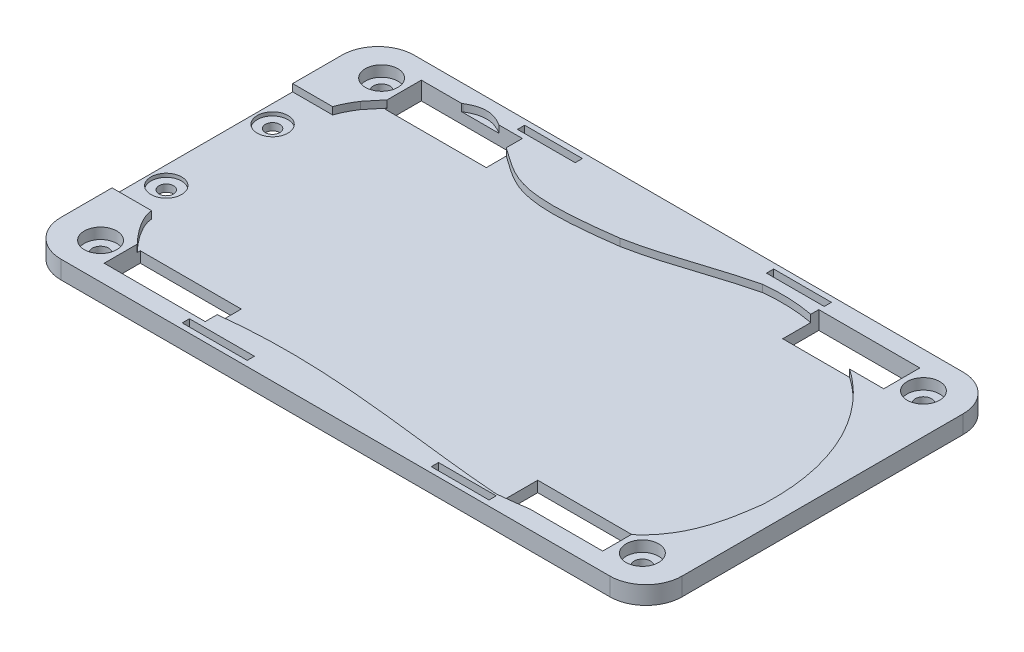
from build123d import *

# Parameters (mm, degrees)
BOSS_EXTRUDE2_DEPTH        = 6.5
CUT_EXTRUDE1_DEPTH         = 2.5
SKETCH7_W                  = 15.126318285
SKETCH7_H                  = 50.045217971
CUT_EXTRUDE2_DEPTH         = 2.5
SKETCH9_R                  = 4.5
CUT_EXTRUDE5_DEPTH         = 3.5
SKETCH10_R                 = 2.25
CUT_EXTRUDE6_DEPTH         = 21
SKETCH8_W                  = 28
SKETCH8_H                  = 10
CUT_EXTRUDE8_DEPTH         = 42
SKETCH8_3_W                = 12
SKETCH8_3_H                = 10
SKETCH8_3_R                = 3.5
CUT_EXTRUDE9_DEPTH         = 1
MIRROR2_COPY_1_SKETCH_R    = 4.5
MIRROR2_COPY_1_DEPTH       = 3.5
MIRROR2_COPY_2_SKETCH_R    = 2.25
MIRROR2_COPY_2_DEPTH       = 21
MIRROR2_COPY_3_SKETCH_W    = 28
MIRROR2_COPY_3_SKETCH_H    = 10
MIRROR2_COPY_3_DEPTH       = 42
MIRROR2_COPY_4_SKETCH_W    = 12
MIRROR2_COPY_4_SKETCH_H    = 10
MIRROR2_COPY_4_SKETCH_R    = 3.5
MIRROR2_COPY_4_DEPTH       = 1
SKETCH13_W                 = 122.138782423
SKETCH13_H                 = 57.881417702
CUT_EXTRUDE10_DEPTH        = 1
SKETCH14_R                 = 2.5
CUT_EXTRUDE11_DEPTH        = 57
SKETCH16_W                 = 16
SKETCH16_H                 = 2
SKETCH16_W_2               = 18
CUT_EXTRUDE12_DEPTH        = 57
SKETCH17_W                 = 198.020150231
SKETCH17_H                 = 122.239022266
CUT_EXTRUDE14_DEPTH        = 48.5
SKETCH23_R                 = 2
CUT_EXTRUDE15_DEPTH        = 48.5
SKETCH23_3_R               = 4.25
SKETCH23_3_R_2             = 2
CUT_EXTRUDE16_DEPTH        = 1
SKETCH24_R                 = 3.25
SKETCH24_R_2               = 2.25
BOSS_EXTRUDE3_DEPTH        = 3
MIRROR5_COPY_1_SKETCH_R    = 4.5
MIRROR5_COPY_1_DEPTH       = 3.5
MIRROR5_COPY_2_SKETCH_R    = 2.25
MIRROR5_COPY_2_DEPTH       = 21
MIRROR5_COPY_3_SKETCH_W    = 28
MIRROR5_COPY_3_SKETCH_H    = 10
MIRROR5_COPY_3_DEPTH       = 42
MIRROR5_COPY_4_SKETCH_W    = 12
MIRROR5_COPY_4_SKETCH_H    = 10
MIRROR5_COPY_4_SKETCH_R    = 3.5
MIRROR5_COPY_4_DEPTH       = 1
MIRROR5_COPY_5_SKETCH_R    = 4.5
MIRROR5_COPY_5_DEPTH       = 3.5
MIRROR5_COPY_6_SKETCH_R    = 2.25
MIRROR5_COPY_6_DEPTH       = 21
MIRROR5_COPY_7_SKETCH_W    = 28
MIRROR5_COPY_7_SKETCH_H    = 10
MIRROR5_COPY_7_DEPTH       = 42
MIRROR5_COPY_8_SKETCH_W    = 12
MIRROR5_COPY_8_SKETCH_H    = 10
MIRROR5_COPY_8_SKETCH_R    = 3.5
MIRROR5_COPY_8_DEPTH       = 1
MIRROR5_COPY_9_SKETCH_R    = 4.5
MIRROR5_COPY_9_DEPTH       = 3.5
MIRROR5_COPY_10_SKETCH_R   = 2.25
MIRROR5_COPY_10_DEPTH      = 21
MIRROR5_COPY_11_SKETCH_W   = 28
MIRROR5_COPY_11_SKETCH_H   = 10
MIRROR5_COPY_11_DEPTH      = 42
MIRROR5_COPY_12_SKETCH_W   = 12
MIRROR5_COPY_12_SKETCH_H   = 10
MIRROR5_COPY_12_SKETCH_R   = 3.5
MIRROR5_COPY_12_DEPTH      = 1
MIRROR5_COPY_13_SKETCH_R   = 2
MIRROR5_COPY_13_DEPTH      = 48.5
MIRROR5_COPY_14_SKETCH_R   = 4.25
MIRROR5_COPY_14_SKETCH_R_2 = 2
MIRROR5_COPY_14_DEPTH      = 1
CUT_EXTRUDE18_START        = -5.5
SKETCH25_W                 = 220.332555495
SKETCH25_H                 = 149.430085415
CUT_EXTRUDE18_DEPTH        = 8.5
SKETCH26_W                 = 210.742237729
SKETCH26_H                 = 121.214001519
CUT_EXTRUDE19_DEPTH        = 0.5
SKETCH27_W                 = 119.619080446
SKETCH27_H                 = 53.164035754
BOSS_EXTRUDE4_DEPTH        = 3


with BuildPart() as part:
    # Sketch6 → Boss-Extrude2 (new body)
    with BuildSketch(Plane(origin=(0, 0, 0), x_dir=(1, 0, 0), z_dir=(0, 1, 0))):
        with BuildLine():
            Line((73.981646775, 59.583909473), (-78.157135648, 59.583909473))
            ThreePointArc((-78.157135648, 59.583909473), (-85.22820346, 56.654977285), (-88.157135648, 49.583909473))
            Line((-88.157135648, 49.583909473), (-88.157135648, -28.297508229))
            ThreePointArc((-88.157135648, -28.297508229), (-85.22820346, -35.368576041), (-78.157135648, -38.297508229))
            Line((-78.157135648, -38.297508229), (73.981646775, -38.297508229))
            ThreePointArc((73.981646775, -38.297508229), (81.052714587, -35.368576041), (83.981646775, -28.297508229))
            Line((83.981646775, -28.297508229), (83.981646775, 49.583909473))
            ThreePointArc((83.981646775, 49.583909473), (81.052714587, 56.654977285), (73.981646775, 59.583909473))
        make_face()
    boss_extrude2 = extrude(amount=BOSS_EXTRUDE2_DEPTH)

    # Sketch1 → Cut-Extrude1 (cut)
    with BuildSketch(Plane(origin=(0, 0, 0), x_dir=(1, 0, 0), z_dir=(0, 1, 0))):
        with BuildLine():
            Line((77.806365081, -0.96565382), (-77.157134057, -0.96565382))
            Line((-77.157134057, -0.96565382), (-77.157133487, -14.112200011))
            add(Edge.make_bspline(
                [(-77.157133487, -14.112200011), (-77.156536942, -14.370123486), (-77.109197781, -14.873209632), (-76.835922488, -15.955912897), (-76.187889009, -17.500769448), (-75.043983016, -19.418277882), (-73.152039277, -22.009216703), (-70.349522729, -25.082160357), (-66.873619377, -28.097169115), (-63.686430755, -30.214139025), (-61.001852204, -31.406236435), (-58.827378352, -31.848010778), (-57.571800044, -31.879365283), (-56.919048161, -31.916770504)],
                knots=[0.000484301, 0.000484301, 0.000484301, 0.000484301, 0.031521334, 0.062558366, 0.124632431, 0.186706496, 0.248780561, 0.37292869, 0.49707682, 0.62122495, 0.745373079, 0.869521209, 0.993669339, 0.993669339, 0.993669339, 0.993669339], degree=3))
            add(Edge.make_bspline(
                [(-56.919048161, -31.916770504), (-56.676855651, -31.887329504), (-56.202107187, -31.827411173), (-55.17909933, -31.687000892), (-53.829380758, -31.487736495), (-52.075898695, -31.218386946), (-49.57440565, -30.835368063), (-46.14645809, -30.337211074), (-41.582465958, -29.781294531), (-36.59758114, -29.326101352), (-29.427370913, -28.913030471), (-19.557102597, -28.846779859), (-6.483877393, -29.587535165), (5.244808229, -30.786505775), (15.023020088, -31.929485511), (22.521025078, -32.809036887), (30.153844065, -33.641998773), (35.340846207, -34.107490241), (37.926285135, -34.298975741)],
                knots=[0.000538145, 0.000538145, 0.000538145, 0.000538145, 0.016151963, 0.031765781, 0.062993416, 0.094221052, 0.125448688, 0.18790396, 0.250359232, 0.312814503, 0.375269775, 0.500180319, 0.625090862, 0.750001406, 0.812456678, 0.874911949, 0.937367221, 0.999822493, 0.999822493, 0.999822493, 0.999822493], degree=3))
            ThreePointArc((37.926285135, -34.298975741), (38.702526051, -34.294429262), (39.475271872, -34.220710033))
            add(Edge.make_bspline(
                [(39.475271872, -34.220710033), (41.007855914, -34.057436076), (44.089984585, -33.714701696), (50.083540013, -32.842915348), (57.096899249, -31.185924421), (64.218389099, -27.883874428), (69.776327895, -23.185685517), (73.049743993, -18.278857828), (74.917700916, -14.026885359), (75.980532113, -10.773207259), (76.750872111, -7.572378035), (77.199527425, -5.064024493), (77.479780782, -3.227934), (77.653952405, -2.012317888), (77.758523252, -1.282417326), (77.806365081, -0.96565382)],
                knots=[-0.000308659, -0.000308659, -0.000308659, -0.000308659, 0.063093373, 0.126495404, 0.253299468, 0.380103532, 0.506907596, 0.633711659, 0.697113691, 0.760515723, 0.823917755, 0.887319787, 0.919020803, 0.950721818, 0.978851886, 0.978851886, 0.978851886, 0.978851886], degree=3))
        make_face()
        with BuildLine():
            Line((-77.157135648, 35.76464303), (-77.157134057, -0.96565382))
            Line((-77.157134057, -0.96565382), (77.806365081, -0.96565382))
            add(Edge.make_bspline(
                [(77.806365081, -0.96565382), (77.812438323, -0.925442533), (77.87221605, -0.53245946), (77.930059012, -0.183407073), (77.984899751, 0.147711222)],
                knots=[0.978851886, 0.978851886, 0.978851886, 0.978851886, 0.982422834, 1.01412385, 1.01412385, 1.01412385, 1.01412385], degree=3))
            add(Edge.make_bspline(
                [(77.984899751, 0.147711222), (78.028632075, 1.263321996), (78.063685274, 3.522430751), (77.942610131, 6.756968322), (77.659550444, 9.90467033), (77.073307047, 13.967118446), (75.962568899, 18.783585703), (73.443316656, 25.935742417), (69.020568834, 33.80984715), (62.049489108, 41.493231365), (53.789484117, 47.344418041), (44.612113932, 51.294661515), (34.903628635, 53.280392725), (28.311253849, 53.235690332), (25.060177828, 52.873239487)],
                knots=[0.000169226, 0.000169226, 0.000169226, 0.000169226, 0.031413574, 0.062657922, 0.09390227, 0.125146618, 0.187635314, 0.25012401, 0.375101401, 0.500078793, 0.625056185, 0.750033577, 0.875010969, 0.999988361, 0.999988361, 0.999988361, 0.999988361], degree=3))
            add(Edge.make_bspline(
                [(25.060177828, 52.873239487), (19.895446944, 51.629390577), (12.322434608, 49.13169364), (2.160698602, 45.971278142), (-3.037110446, 44.691336857), (-5.659268145, 44.190364293)],
                knots=[0.000658959, 0.000658959, 0.000658959, 0.000658959, 0.498067368, 0.746771573, 0.995475778, 0.995475778, 0.995475778, 0.995475778], degree=3))
            add(Edge.make_bspline(
                [(-5.659268145, 44.190364293), (-6.687899132, 44.046149587), (-8.728734339, 43.771857825), (-12.963271971, 43.266800577), (-18.182613839, 42.795189919), (-23.901458121, 42.63215561), (-28.830638135, 42.989857068), (-32.966568973, 43.951399156), (-35.917714049, 45.291439085), (-38.19591431, 46.677930402), (-39.939161114, 47.865789175), (-41.506959745, 48.979842665), (-42.863802202, 49.929184347), (-43.616290768, 50.440510486), (-43.98532936, 50.688555671)],
                knots=[-0.00019559, -0.00019559, -0.00019559, -0.00019559, 0.062587211, 0.125370012, 0.250935613, 0.376501215, 0.502066816, 0.627632417, 0.753198019, 0.81598082, 0.87876362, 0.941546421, 0.972937821, 1.004329222, 1.004329222, 1.004329222, 1.004329222], degree=3))
            add(Edge.make_bspline(
                [(-43.98532936, 50.688555671), (-44.244485854, 50.867312015), (-44.768150418, 51.232519494), (-45.750657054, 51.933111662), (-46.891239492, 52.75905139), (-48.145972585, 53.649626958), (-49.697116091, 54.681113287), (-51.460780236, 55.648746777), (-53.407719169, 56.259273829), (-55.251731489, 56.357375065), (-56.710973324, 56.08081223), (-57.794758617, 55.713765742), (-58.546542767, 55.391458897), (-59.229896481, 55.042763399), (-59.583745645, 54.835934013), (-59.770155285, 54.723823826)],
                knots=[-0.002497219, -0.002497219, -0.002497219, -0.002497219, 0.029065652, 0.060628523, 0.123754265, 0.186880007, 0.250005749, 0.376257234, 0.502508718, 0.628760202, 0.755011687, 0.818137429, 0.881263171, 0.944388913, 1.007514655, 1.007514655, 1.007514655, 1.007514655], degree=3))
            add(Edge.make_bspline(
                [(-59.770155285, 54.723823826), (-60.193626174, 54.476092852), (-61.03864602, 53.961192652), (-62.636768194, 52.907176262), (-65.258656407, 50.976312285), (-68.51709364, 48.049765778), (-71.244275363, 45.065662035), (-73.189921829, 42.724657875), (-74.069794154, 41.617885903), (-74.515784144, 41.052117052)],
                knots=[0.000174078, 0.000174078, 0.000174078, 0.000174078, 0.062881444, 0.12558881, 0.251003541, 0.501833004, 0.752662466, 0.878077198, 1.003491929, 1.003491929, 1.003491929, 1.003491929], degree=3))
            add(Edge.make_bspline(
                [(-74.515784144, 41.052117052), (-75.065753244, 40.22169422), (-76.07645723, 38.477870595), (-76.833603448, 36.687528936), (-77.157135648, 35.76464303)],
                knots=[0.499549048, 0.499549048, 0.499549048, 0.499549048, 0.499765799, 0.49998255, 0.49998255, 0.49998255, 0.49998255], degree=3))
        make_face()
    cut_extrude1 = extrude(amount=CUT_EXTRUDE1_DEPTH, mode=Mode.SUBTRACT)

    # Sketch7 → Cut-Extrude2 (cut)
    with BuildSketch(Plane.XZ):
        with Locations((-83.782077592, -10.91040897)):
            Rectangle(SKETCH7_W, SKETCH7_H)
    cut_extrude2 = extrude(amount=-CUT_EXTRUDE2_DEPTH, mode=Mode.SUBTRACT)

    # Sketch9 → Cut-Extrude5 (cut)
    with BuildSketch(Plane.XZ):
        with Locations(Location((72.981646775, -49.583909473, 0), (0, 0, 270))):
            Circle(SKETCH9_R)
    cut_extrude5 = extrude(amount=-CUT_EXTRUDE5_DEPTH, mode=Mode.SUBTRACT)

    # Sketch10 → Cut-Extrude6 (cut)
    with BuildSketch(Plane.XZ.offset(-3.5)):
        with Locations(Location((72.981646775, -49.583909473, 0), (0, 0, 270))):
            Circle(SKETCH10_R)
    cut_extrude6 = extrude(amount=-CUT_EXTRUDE6_DEPTH, mode=Mode.SUBTRACT)

    # Sketch8 → Cut-Extrude8 (cut)
    with BuildSketch(Plane(origin=(0, 6.5, 0), x_dir=(1, 0, 0), z_dir=(0, 1, 0))):
        with Locations((52.981646775, 49.583909473)):
            Rectangle(SKETCH8_W, SKETCH8_H)
    cut_extrude8 = extrude(amount=-CUT_EXTRUDE8_DEPTH, mode=Mode.SUBTRACT)

    # Sketch8<3> → Cut-Extrude9 (cut)
    with BuildSketch(Plane(origin=(0, 6.5, 0), x_dir=(1, 0, 0), z_dir=(0, 1, 0))):
        with Locations((72.981646775, 49.583909473)):
            Rectangle(SKETCH8_3_W, SKETCH8_3_H)
        with Locations(Location((72.981646775, 49.583909473, 0), (0, 0, 270))):
            Circle(SKETCH8_3_R, mode=Mode.SUBTRACT)
    cut_extrude9 = extrude(amount=-CUT_EXTRUDE9_DEPTH, mode=Mode.SUBTRACT)

    # Mirror1: Cut-Extrude5, Cut-Extrude6, Cut-Extrude8, Cut-Extrude9 across plane
    add(cut_extrude5.mirror(Plane.XY.offset(-10.643200622)), mode=Mode.SUBTRACT)
    add(cut_extrude6.mirror(Plane.XY.offset(-10.643200622)), mode=Mode.SUBTRACT)
    add(cut_extrude8.mirror(Plane.XY.offset(-10.643200622)), mode=Mode.SUBTRACT)
    add(cut_extrude9.mirror(Plane.XY.offset(-10.643200622)), mode=Mode.SUBTRACT)

    # Mirror2: Cut-Extrude5, Cut-Extrude6, Cut-Extrude8, Cut-Extrude9 across plane
    add(cut_extrude5.mirror(Plane.ZY.offset(2.087744437)), mode=Mode.SUBTRACT)
    add(cut_extrude6.mirror(Plane.ZY.offset(2.087744437)), mode=Mode.SUBTRACT)
    add(cut_extrude8.mirror(Plane.ZY.offset(2.087744437)), mode=Mode.SUBTRACT)
    add(cut_extrude9.mirror(Plane.ZY.offset(2.087744437)), mode=Mode.SUBTRACT)

    # Mirror2 copy 1 sketch → Mirror2 copy 1 (cut)
    with BuildSketch(Plane(origin=(-4.175488873, 0, -21.286401244), x_dir=(-1, 0, 0), z_dir=(0, -1, 0))):
        with Locations(Location((72.981646775, -49.583909473, 0), (0, 0, 270))):
            Circle(MIRROR2_COPY_1_SKETCH_R)
    extrude(amount=-MIRROR2_COPY_1_DEPTH, mode=Mode.SUBTRACT)

    # Mirror2 copy 2 sketch → Mirror2 copy 2 (cut)
    with BuildSketch(Plane(origin=(-4.175488873, 3.5, -21.286401244), x_dir=(-1, 0, 0), z_dir=(0, -1, 0))):
        with Locations(Location((72.981646775, -49.583909473, 0), (0, 0, 270))):
            Circle(MIRROR2_COPY_2_SKETCH_R)
    extrude(amount=-MIRROR2_COPY_2_DEPTH, mode=Mode.SUBTRACT)

    # Mirror2 copy 3 sketch → Mirror2 copy 3 (cut)
    with BuildSketch(Plane(origin=(-4.175488873, 6.5, -21.286401244), x_dir=(-1, 0, 0), z_dir=(0, 1, 0))):
        with Locations((52.981646775, 49.583909473)):
            Rectangle(MIRROR2_COPY_3_SKETCH_W, MIRROR2_COPY_3_SKETCH_H)
    extrude(amount=-MIRROR2_COPY_3_DEPTH, mode=Mode.SUBTRACT)

    # Mirror2 copy 4 sketch → Mirror2 copy 4 (cut)
    with BuildSketch(Plane(origin=(-4.175488873, 6.5, -21.286401244), x_dir=(-1, 0, 0), z_dir=(0, 1, 0))):
        with Locations((72.981646775, 49.583909473)):
            Rectangle(MIRROR2_COPY_4_SKETCH_W, MIRROR2_COPY_4_SKETCH_H)
        with Locations(Location((72.981646775, 49.583909473, 0), (0, 0, 270))):
            Circle(MIRROR2_COPY_4_SKETCH_R, mode=Mode.SUBTRACT)
    extrude(amount=-MIRROR2_COPY_4_DEPTH, mode=Mode.SUBTRACT)

    # Sketch13 → Cut-Extrude10 (cut)
    with BuildSketch(Plane(origin=(0, 6.5, 0), x_dir=(1, 0, 0), z_dir=(0, 1, 0))):
        with Locations((-2.087744436, 10.643200622)):
            Rectangle(SKETCH13_W, SKETCH13_H)
    cut_extrude10 = extrude(amount=-CUT_EXTRUDE10_DEPTH, mode=Mode.SUBTRACT)

    # Sketch14 → Cut-Extrude11 (cut)
    with BuildSketch(Plane(origin=(0, 5.5, 0), x_dir=(1, 0, 0), z_dir=(0, 1, 0))):
        with Locations(Location((-52.087744437, 30.643200622, 0), (0, 0, 270))):
            Circle(SKETCH14_R)
        with Locations(Location((7.912255563, 30.643200622, 0), (0, 0, 270))):
            Circle(SKETCH14_R)
        with Locations(Location((27.912255563, 30.643200622, 0), (0, 0, 270))):
            Circle(SKETCH14_R)
        with Locations(Location((47.912255563, 30.643200622, 0), (0, 0, 270))):
            Circle(SKETCH14_R)
        with Locations(Location((47.912255563, 10.643200622, 0), (0, 0, 270))):
            Circle(SKETCH14_R)
        with Locations(Location((7.912255563, 10.643200622, 0), (0, 0, 270))):
            Circle(SKETCH14_R)
        with Locations(Location((-12.087744437, 10.643200622, 0), (0, 0, 270))):
            Circle(SKETCH14_R)
        with Locations(Location((-32.087744437, 10.643200622, 0), (0, 0, 270))):
            Circle(SKETCH14_R)
        with Locations(Location((-52.087744437, 10.643200622, 0), (0, 0, 270))):
            Circle(SKETCH14_R)
        with Locations(Location((47.912255563, -9.356799378, 0), (0, 0, 270))):
            Circle(SKETCH14_R)
        with Locations(Location((27.912255563, -9.356799378, 0), (0, 0, 270))):
            Circle(SKETCH14_R)
        with Locations(Location((7.912255563, -9.356799378, 0), (0, 0, 270))):
            Circle(SKETCH14_R)
        with Locations(Location((-12.087744437, -9.356799378, 0), (0, 0, 270))):
            Circle(SKETCH14_R)
        with Locations(Location((-32.087744437, -9.356799378, 0), (0, 0, 270))):
            Circle(SKETCH14_R)
        with Locations(Location((-52.087744437, -9.356799378, 0), (0, 0, 270))):
            Circle(SKETCH14_R)
        with Locations(Location((-32.087744437, 30.643200622, 0), (0, 0, 270))):
            Circle(SKETCH14_R)
        with Locations(Location((-12.087744437, 30.643200622, 0), (0, 0, 270))):
            Circle(SKETCH14_R)
        with Locations(Location((27.912255563, 10.643200622, 0), (0, 0, 270))):
            Circle(SKETCH14_R)
    cut_extrude11 = extrude(amount=-CUT_EXTRUDE11_DEPTH, mode=Mode.SUBTRACT)

    # Sketch16 → Cut-Extrude12 (cut)
    with BuildSketch(Plane.XZ):
        with Locations((30.981646775, -57.083909473)):
            Rectangle(SKETCH16_W, SKETCH16_H)
        with Locations((30.981646775, 35.797508229)):
            Rectangle(SKETCH16_W, SKETCH16_H)
        with Locations((-38.018353225, -57.083909473)):
            Rectangle(SKETCH16_W, SKETCH16_H)
        with Locations((-37.018353225, 35.797508229)):
            Rectangle(SKETCH16_W_2, SKETCH16_H)
    cut_extrude12 = extrude(amount=-CUT_EXTRUDE12_DEPTH, mode=Mode.SUBTRACT)

    # Sketch17 → Cut-Extrude14 (cut)
    with BuildSketch(Plane(origin=(0, 5.5, 0), x_dir=(1, 0, 0), z_dir=(0, 1, 0))):
        with Locations((-0.586253557, 7.90518784)):
            Rectangle(SKETCH17_W, SKETCH17_H)
    cut_extrude14 = extrude(amount=CUT_EXTRUDE14_DEPTH, mode=Mode.SUBTRACT)

    # Sketch23 → Cut-Extrude15 (cut)
    with BuildSketch(Plane.XZ.offset(-2.5)):
        with Locations(Location((-83.157135648, 4.08959103, 0), (0, 0, 270))):
            Circle(SKETCH23_R)
    cut_extrude15 = extrude(amount=-CUT_EXTRUDE15_DEPTH, mode=Mode.SUBTRACT)

    # Sketch23<3> → Cut-Extrude16 (cut)
    with BuildSketch(Plane.XZ.offset(-2.5)):
        with Locations(Location((-83.157135648, 4.08959103, 0), (0, 0, 270))):
            Circle(SKETCH23_3_R)
        with Locations(Location((-83.157135648, 4.08959103, 0), (0, 0, 270))):
            Circle(SKETCH23_3_R_2, mode=Mode.SUBTRACT)
    cut_extrude16 = extrude(amount=-CUT_EXTRUDE16_DEPTH, mode=Mode.SUBTRACT)

    # Mirror4: Cut-Extrude15, Cut-Extrude16 across plane
    add(cut_extrude15.mirror(Plane.XY.offset(-10.643200622)), mode=Mode.SUBTRACT)
    add(cut_extrude16.mirror(Plane.XY.offset(-10.643200622)), mode=Mode.SUBTRACT)

    # Sketch24 → Boss-Extrude3 (add)
    # profile 1 of 4: a face of its own
    with BuildSketch(Plane(origin=(0, 5.5, 0), x_dir=(1, 0, 0), z_dir=(0, 1, 0))):
        with Locations(Location((-77.157135648, 49.583909473, 0), (0, 0, 270))):
            Circle(SKETCH24_R)
        with Locations(Location((-77.157135648, 49.583909473, 0), (0, 0, 90))):
            Circle(SKETCH24_R_2, mode=Mode.SUBTRACT)
    # profile 2 of 4: a face of its own
    with BuildSketch(Plane(origin=(0, 5.5, 0), x_dir=(1, 0, 0), z_dir=(0, 1, 0))):
        with Locations(Location((72.981646775, 49.583909473, 0), (0, 0, 270))):
            Circle(SKETCH24_R)
        with Locations(Location((72.981646775, 49.583909473, 0), (0, 0, 90))):
            Circle(SKETCH24_R_2, mode=Mode.SUBTRACT)
    # profile 3 of 4: a face of its own
    with BuildSketch(Plane(origin=(0, 5.5, 0), x_dir=(1, 0, 0), z_dir=(0, 1, 0))):
        with Locations(Location((-77.157135648, -28.297508229, 0), (0, 0, 270))):
            Circle(SKETCH24_R)
        with Locations(Location((-77.157135648, -28.297508229, 0), (0, 0, 270))):
            Circle(SKETCH24_R_2, mode=Mode.SUBTRACT)
    # profile 4 of 4: a face of its own
    with BuildSketch(Plane(origin=(0, 5.5, 0), x_dir=(1, 0, 0), z_dir=(0, 1, 0))):
        with Locations(Location((72.981646775, -28.297508229, 0), (0, 0, 270))):
            Circle(SKETCH24_R)
        with Locations(Location((72.981646775, -28.297508229, 0), (0, 0, 270))):
            Circle(SKETCH24_R_2, mode=Mode.SUBTRACT)
    boss_extrude3 = extrude(amount=BOSS_EXTRUDE3_DEPTH)

    # Mirror5: Boss-Extrude2, Cut-Extrude1, Cut-Extrude2, Cut-Extrude5, Cut-Extrude6, Cut-Extrude8, Cut-Extrude9, Cut-Extrude10, Cut-Extrude11, Cut-Extrude12, Cut-Extrude14, Cut-Extrude15, Cut-Extrude16, Boss-Extrude3 across plane
    add(boss_extrude2.mirror(Plane(origin=(0, 0, 0), x_dir=(0, 0, 1), z_dir=(0, -1, 0))))
    add(cut_extrude1.mirror(Plane(origin=(0, 0, 0), x_dir=(0, 0, 1), z_dir=(0, -1, 0))), mode=Mode.SUBTRACT)
    add(cut_extrude2.mirror(Plane(origin=(0, 0, 0), x_dir=(0, 0, 1), z_dir=(0, -1, 0))), mode=Mode.SUBTRACT)
    add(cut_extrude5.mirror(Plane(origin=(0, 0, 0), x_dir=(0, 0, 1), z_dir=(0, -1, 0))), mode=Mode.SUBTRACT)
    add(cut_extrude6.mirror(Plane(origin=(0, 0, 0), x_dir=(0, 0, 1), z_dir=(0, -1, 0))), mode=Mode.SUBTRACT)
    add(cut_extrude8.mirror(Plane(origin=(0, 0, 0), x_dir=(0, 0, 1), z_dir=(0, -1, 0))), mode=Mode.SUBTRACT)
    add(cut_extrude9.mirror(Plane(origin=(0, 0, 0), x_dir=(0, 0, 1), z_dir=(0, -1, 0))), mode=Mode.SUBTRACT)
    add(cut_extrude10.mirror(Plane(origin=(0, 0, 0), x_dir=(0, 0, 1), z_dir=(0, -1, 0))), mode=Mode.SUBTRACT)
    add(cut_extrude11.mirror(Plane(origin=(0, 0, 0), x_dir=(0, 0, 1), z_dir=(0, -1, 0))), mode=Mode.SUBTRACT)
    add(cut_extrude12.mirror(Plane(origin=(0, 0, 0), x_dir=(0, 0, 1), z_dir=(0, -1, 0))), mode=Mode.SUBTRACT)
    add(cut_extrude14.mirror(Plane(origin=(0, 0, 0), x_dir=(0, 0, 1), z_dir=(0, -1, 0))), mode=Mode.SUBTRACT)
    add(cut_extrude15.mirror(Plane(origin=(0, 0, 0), x_dir=(0, 0, 1), z_dir=(0, -1, 0))), mode=Mode.SUBTRACT)
    add(cut_extrude16.mirror(Plane(origin=(0, 0, 0), x_dir=(0, 0, 1), z_dir=(0, -1, 0))), mode=Mode.SUBTRACT)
    add(boss_extrude3.mirror(Plane(origin=(0, 0, 0), x_dir=(0, 0, 1), z_dir=(0, -1, 0))))

    # Mirror5 copy 1 sketch → Mirror5 copy 1 (cut)
    with BuildSketch(Plane(origin=(0, 0, -21.286401244), x_dir=(1, 0, 0), z_dir=(0, 1, 0))):
        with Locations(Location((72.981646775, -49.583909473, 0), (0, 0, 270))):
            Circle(MIRROR5_COPY_1_SKETCH_R)
    extrude(amount=-MIRROR5_COPY_1_DEPTH, mode=Mode.SUBTRACT)

    # Mirror5 copy 2 sketch → Mirror5 copy 2 (cut)
    with BuildSketch(Plane(origin=(0, -3.5, -21.286401244), x_dir=(1, 0, 0), z_dir=(0, 1, 0))):
        with Locations(Location((72.981646775, -49.583909473, 0), (0, 0, 270))):
            Circle(MIRROR5_COPY_2_SKETCH_R)
    extrude(amount=-MIRROR5_COPY_2_DEPTH, mode=Mode.SUBTRACT)

    # Mirror5 copy 3 sketch → Mirror5 copy 3 (cut)
    with BuildSketch(Plane(origin=(0, -6.5, -21.286401244), x_dir=(1, 0, 0), z_dir=(0, -1, 0))):
        with Locations((52.981646775, 49.583909473)):
            Rectangle(MIRROR5_COPY_3_SKETCH_W, MIRROR5_COPY_3_SKETCH_H)
    extrude(amount=-MIRROR5_COPY_3_DEPTH, mode=Mode.SUBTRACT)

    # Mirror5 copy 4 sketch → Mirror5 copy 4 (cut)
    with BuildSketch(Plane(origin=(0, -6.5, -21.286401244), x_dir=(1, 0, 0), z_dir=(0, -1, 0))):
        with Locations((72.981646775, 49.583909473)):
            Rectangle(MIRROR5_COPY_4_SKETCH_W, MIRROR5_COPY_4_SKETCH_H)
        with Locations(Location((72.981646775, 49.583909473, 0), (0, 0, 270))):
            Circle(MIRROR5_COPY_4_SKETCH_R, mode=Mode.SUBTRACT)
    extrude(amount=-MIRROR5_COPY_4_DEPTH, mode=Mode.SUBTRACT)

    # Mirror5 copy 5 sketch → Mirror5 copy 5 (cut)
    with BuildSketch(Plane(origin=(-4.175488873, 0, 0), x_dir=(-1, 0, 0), z_dir=(0, 1, 0))):
        with Locations(Location((72.981646775, -49.583909473, 0), (0, 0, 270))):
            Circle(MIRROR5_COPY_5_SKETCH_R)
    extrude(amount=-MIRROR5_COPY_5_DEPTH, mode=Mode.SUBTRACT)

    # Mirror5 copy 6 sketch → Mirror5 copy 6 (cut)
    with BuildSketch(Plane(origin=(-4.175488873, -3.5, 0), x_dir=(-1, 0, 0), z_dir=(0, 1, 0))):
        with Locations(Location((72.981646775, -49.583909473, 0), (0, 0, 270))):
            Circle(MIRROR5_COPY_6_SKETCH_R)
    extrude(amount=-MIRROR5_COPY_6_DEPTH, mode=Mode.SUBTRACT)

    # Mirror5 copy 7 sketch → Mirror5 copy 7 (cut)
    with BuildSketch(Plane(origin=(-4.175488873, -6.5, 0), x_dir=(-1, 0, 0), z_dir=(0, -1, 0))):
        with Locations((52.981646775, 49.583909473)):
            Rectangle(MIRROR5_COPY_7_SKETCH_W, MIRROR5_COPY_7_SKETCH_H)
    extrude(amount=-MIRROR5_COPY_7_DEPTH, mode=Mode.SUBTRACT)

    # Mirror5 copy 8 sketch → Mirror5 copy 8 (cut)
    with BuildSketch(Plane(origin=(-4.175488873, -6.5, 0), x_dir=(-1, 0, 0), z_dir=(0, -1, 0))):
        with Locations((72.981646775, 49.583909473)):
            Rectangle(MIRROR5_COPY_8_SKETCH_W, MIRROR5_COPY_8_SKETCH_H)
        with Locations(Location((72.981646775, 49.583909473, 0), (0, 0, 270))):
            Circle(MIRROR5_COPY_8_SKETCH_R, mode=Mode.SUBTRACT)
    extrude(amount=-MIRROR5_COPY_8_DEPTH, mode=Mode.SUBTRACT)

    # Mirror5 copy 9 sketch → Mirror5 copy 9 (cut)
    with BuildSketch(Plane(origin=(-4.175488873, 0, -21.286401244), x_dir=(-1, 0, 0), z_dir=(0, 1, 0))):
        with Locations((72.981646775, 49.583909473)):
            Circle(MIRROR5_COPY_9_SKETCH_R)
    extrude(amount=-MIRROR5_COPY_9_DEPTH, mode=Mode.SUBTRACT)

    # Mirror5 copy 10 sketch → Mirror5 copy 10 (cut)
    with BuildSketch(Plane(origin=(-4.175488873, -3.5, -21.286401244), x_dir=(-1, 0, 0), z_dir=(0, 1, 0))):
        with Locations((72.981646775, 49.583909473)):
            Circle(MIRROR5_COPY_10_SKETCH_R)
    extrude(amount=-MIRROR5_COPY_10_DEPTH, mode=Mode.SUBTRACT)

    # Mirror5 copy 11 sketch → Mirror5 copy 11 (cut)
    with BuildSketch(Plane(origin=(-4.175488873, -6.5, -21.286401244), x_dir=(-1, 0, 0), z_dir=(0, -1, 0))):
        with Locations((52.981646775, -49.583909473)):
            Rectangle(MIRROR5_COPY_11_SKETCH_W, MIRROR5_COPY_11_SKETCH_H)
    extrude(amount=-MIRROR5_COPY_11_DEPTH, mode=Mode.SUBTRACT)

    # Mirror5 copy 12 sketch → Mirror5 copy 12 (cut)
    with BuildSketch(Plane(origin=(-4.175488873, -6.5, -21.286401244), x_dir=(-1, 0, 0), z_dir=(0, -1, 0))):
        with Locations((72.981646775, -49.583909473)):
            Rectangle(MIRROR5_COPY_12_SKETCH_W, MIRROR5_COPY_12_SKETCH_H)
        with Locations((72.981646775, -49.583909473)):
            Circle(MIRROR5_COPY_12_SKETCH_R, mode=Mode.SUBTRACT)
    extrude(amount=-MIRROR5_COPY_12_DEPTH, mode=Mode.SUBTRACT)

    # Mirror5 copy 13 sketch → Mirror5 copy 13 (cut)
    with BuildSketch(Plane(origin=(0, -2.5, -21.286401244), x_dir=(1, 0, 0), z_dir=(0, 1, 0))):
        with Locations(Location((-83.157135648, 4.08959103, 0), (0, 0, 270))):
            Circle(MIRROR5_COPY_13_SKETCH_R)
    extrude(amount=-MIRROR5_COPY_13_DEPTH, mode=Mode.SUBTRACT)

    # Mirror5 copy 14 sketch → Mirror5 copy 14 (cut)
    with BuildSketch(Plane(origin=(0, -2.5, -21.286401244), x_dir=(1, 0, 0), z_dir=(0, 1, 0))):
        with Locations(Location((-83.157135648, 4.08959103, 0), (0, 0, 270))):
            Circle(MIRROR5_COPY_14_SKETCH_R)
        with Locations(Location((-83.157135648, 4.08959103, 0), (0, 0, 270))):
            Circle(MIRROR5_COPY_14_SKETCH_R_2, mode=Mode.SUBTRACT)
    extrude(amount=-MIRROR5_COPY_14_DEPTH, mode=Mode.SUBTRACT)

    # Sketch25 → Cut-Extrude18 (cut)
    with BuildSketch(Plane(origin=(0, 5.5, 0), x_dir=(1, 0, 0), z_dir=(0, 1, 0)).offset(CUT_EXTRUDE18_START)):
        with Locations((0.879197772, -1.00848127)):
            Rectangle(SKETCH25_W, SKETCH25_H)
    extrude(amount=CUT_EXTRUDE18_DEPTH, mode=Mode.SUBTRACT)

    # Sketch26 → Cut-Extrude19 (cut)
    with BuildSketch(Plane(origin=(0, 0, 0), x_dir=(1, 0, 0), z_dir=(0, 1, 0))):
        with Locations((0.719275932, 8.451886002)):
            Rectangle(SKETCH26_W, SKETCH26_H)
    extrude(amount=-CUT_EXTRUDE19_DEPTH, mode=Mode.SUBTRACT)

    # Sketch27 → Boss-Extrude4 (add)
    with BuildSketch(Plane(origin=(0, -2.5, 0), x_dir=(1, 0, 0), z_dir=(0, 1, 0))):
        with Locations((-0.149069985, 10.731807348)):
            Rectangle(SKETCH27_W, SKETCH27_H)
    extrude(amount=-BOSS_EXTRUDE4_DEPTH)


solid = part.part
